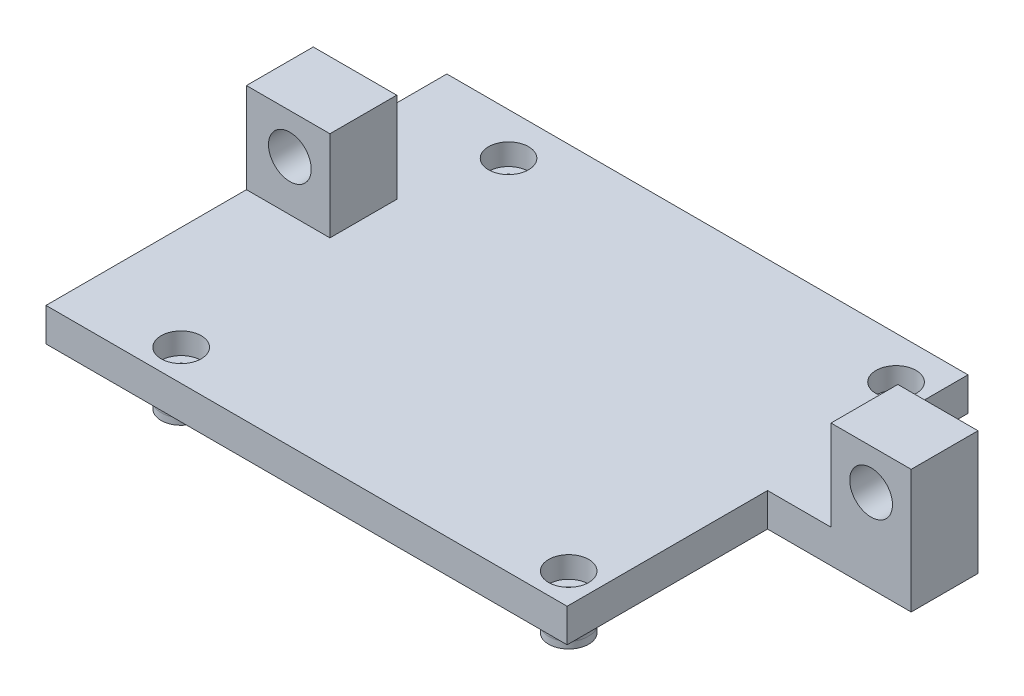
from build123d import *

# Parameters (mm, degrees)
SKETCH1_R               = 3.2
BOSS_EXTRUDE1_DEPTH     = 10
SKETCH2_W               = 78
SKETCH2_H               = 5
BOSS_EXTRUDE2_DEPTH     = 30
SKETCH4_R               = 3
BOSS_EXTRUDE3_DEPTH     = 3
CUT_EXTRUDE1_REACH      = 112.623
CUT_EXTRUDE1_START      = -1.8
SKETCH4_2_R             = 3
CUT_EXTRUDE2_DEPTH      = 109.823251192
CUT_EXTRUDE2_DEPTH_BACK = 109.823251192
SKETCH3_R               = 1.6
FILLET1_R               = 2


with BuildPart() as part:
    # Sketch1 → Boss-Extrude1 (new body)
    with BuildSketch(Plane.XY):
        Polygon((99.5, 12.5), (87.5, 12.5), (87.5, -1), (12.5, -1), (12.5, 12.5), (0, 12.5), (0, -6), (99.5, -6), align=None)
        with Locations((93.5, 6.5)):
            Circle(SKETCH1_R, mode=Mode.SUBTRACT)
        with Locations((6.5, 6.5)):
            Circle(SKETCH1_R, mode=Mode.SUBTRACT)
    extrude(amount=BOSS_EXTRUDE1_DEPTH)

    # Sketch2 → Boss-Extrude2 (add, symmetric)
    with BuildSketch(Plane.XY.offset(10)):
        with Locations((39, -3.5)):
            Rectangle(SKETCH2_W, SKETCH2_H)
    extrude(amount=BOSS_EXTRUDE2_DEPTH, both=True)

    # Sketch4 → Boss-Extrude3 (add)
    with BuildSketch(Plane.XZ.offset(6)):
        with Locations((15.543959644, 35.31000124)):
            Circle(SKETCH4_R)
        with Locations((73.543959644, 35.31000124)):
            Circle(SKETCH4_R)
        with Locations((73.543959644, -13.68999876)):
            Circle(SKETCH4_R)
        with Locations((15.543959644, -13.68999876)):
            Circle(SKETCH4_R)
    extrude(amount=BOSS_EXTRUDE3_DEPTH)

    # Sketch4<2> → Cut-Extrude1 (cut, up to next)
    with BuildSketch(Plane.XZ.offset(6).offset(CUT_EXTRUDE1_START), mode=Mode.PRIVATE) as cut_extrude1_sk1:
        with Locations((15.543959644, 35.31000124)):
            Circle(SKETCH4_2_R)
    cut_extrude1_tool1 = extrude(cut_extrude1_sk1.sketch, amount=-CUT_EXTRUDE1_REACH, mode=Mode.PRIVATE) & part.part
    # Sketch4<2> → Cut-Extrude1 (cut, up to next)
    with BuildSketch(Plane.XZ.offset(6).offset(CUT_EXTRUDE1_START), mode=Mode.PRIVATE) as cut_extrude1_sk2:
        with Locations((73.543959644, 35.31000124)):
            Circle(SKETCH4_2_R)
    cut_extrude1_tool2 = extrude(cut_extrude1_sk2.sketch, amount=-CUT_EXTRUDE1_REACH, mode=Mode.PRIVATE) & part.part
    # Sketch4<2> → Cut-Extrude1 (cut, up to next)
    with BuildSketch(Plane.XZ.offset(6).offset(CUT_EXTRUDE1_START), mode=Mode.PRIVATE) as cut_extrude1_sk3:
        with Locations((73.543959644, -13.68999876)):
            Circle(SKETCH4_2_R)
    cut_extrude1_tool3 = extrude(cut_extrude1_sk3.sketch, amount=-CUT_EXTRUDE1_REACH, mode=Mode.PRIVATE) & part.part
    # Sketch4<2> → Cut-Extrude1 (cut, up to next)
    with BuildSketch(Plane.XZ.offset(6).offset(CUT_EXTRUDE1_START), mode=Mode.PRIVATE) as cut_extrude1_sk4:
        with Locations((15.543959644, -13.68999876)):
            Circle(SKETCH4_2_R)
    cut_extrude1_tool4 = extrude(cut_extrude1_sk4.sketch, amount=-CUT_EXTRUDE1_REACH, mode=Mode.PRIVATE) & part.part
    add(cut_extrude1_tool1.solids().sort_by_distance((15.54396, -4.2, 35.310001))[0], mode=Mode.SUBTRACT)
    add(cut_extrude1_tool2.solids().sort_by_distance((73.54396, -4.2, 35.310001))[0], mode=Mode.SUBTRACT)
    add(cut_extrude1_tool3.solids().sort_by_distance((73.54396, -4.2, -13.689999))[0], mode=Mode.SUBTRACT)
    add(cut_extrude1_tool4.solids().sort_by_distance((15.54396, -4.2, -13.689999))[0], mode=Mode.SUBTRACT)

    # Sketch3 → Cut-Extrude2 (cut, two sides: drawn at the far end of the back side and taken through both)
    with BuildSketch(Plane.XZ.offset(6).offset(-CUT_EXTRUDE2_DEPTH_BACK)):
        with Locations((15.543959644, 35.31000124)):
            Circle(SKETCH3_R)
        with Locations((73.543959644, 35.31000124)):
            Circle(SKETCH3_R)
        with Locations((15.543959644, -13.68999876)):
            Circle(SKETCH3_R)
        with Locations((73.543959644, -13.68999876)):
            Circle(SKETCH3_R)
    extrude(amount=CUT_EXTRUDE2_DEPTH + CUT_EXTRUDE2_DEPTH_BACK, mode=Mode.SUBTRACT)

    # Fillet1
    fillet1_edges = [part.edges().sort_by_distance(p)[0] for p in [
        (70.543959644, -6, -13.68999876),
        (12.543959644, -6, -13.68999876),
        (70.543959644, -6, 35.31000124),
        (12.543959644, -6, 35.31000124),
    ]]
    fillet(fillet1_edges, radius=FILLET1_R)


solid = part.part
